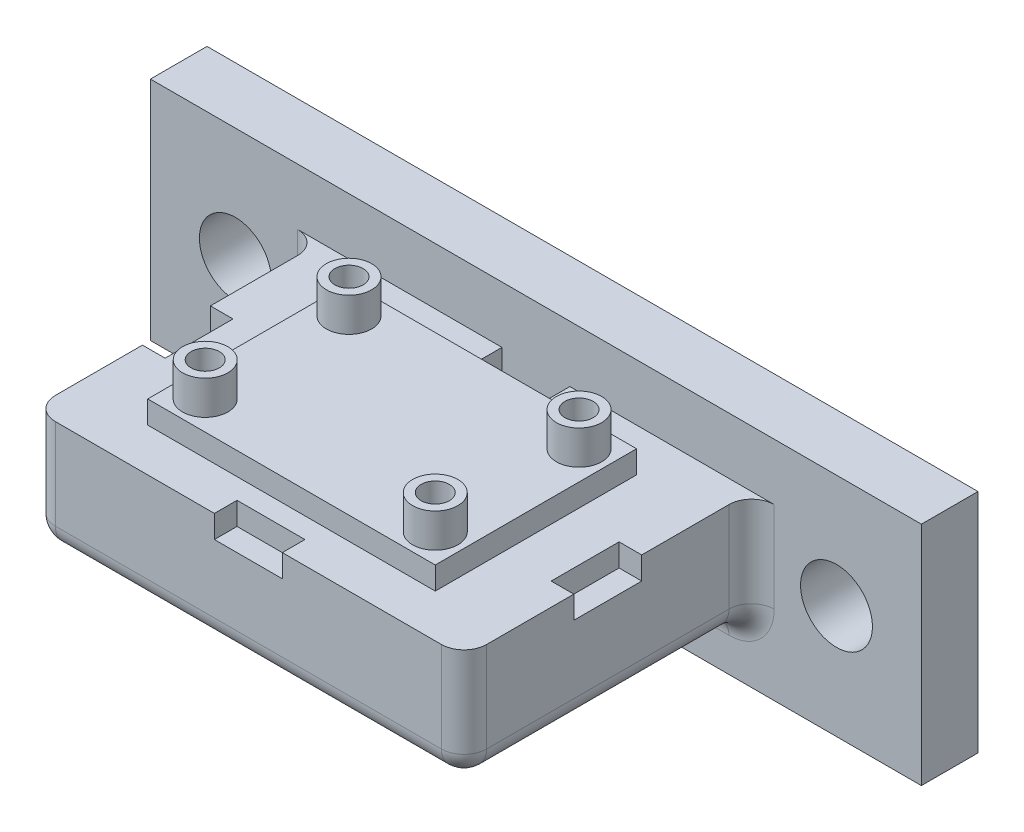
from build123d import *

# Parameters (mm, degrees)
SKETCH1_R             = 2
BOSS_EXTRUDE1_DEPTH   = 5
BOSS_EXTRUDE1_2_DEPTH = 5
BOSS_EXTRUDE1_3_DEPTH = 5
BOSS_EXTRUDE1_4_DEPTH = 5
SKETCH3_W             = 38.1
SKETCH3_H             = 25.4
BOSS_EXTRUDE2_DEPTH   = 10
SKETCH4_W             = 25.4
SKETCH4_H             = 17.78
BOSS_EXTRUDE3_DEPTH   = 2
SKETCH2_R             = 1.25
CUT_EXTRUDE1_DEPTH    = 10
SKETCH6_W             = 5.998216144
SKETCH6_H             = 2
CUT_EXTRUDE3_DEPTH    = 2
SKETCH7_W             = 6
SKETCH7_H             = 2
CUT_EXTRUDE4_DEPTH    = 2
SKETCH8_W             = 68.1
SKETCH8_H             = 20
BOSS_EXTRUDE4_DEPTH   = 5
SKETCH9_R             = 3.175
CUT_EXTRUDE5_DEPTH    = 5
FILLET1_R             = 2


with BuildPart() as part:
    # Sketch1 → Boss-Extrude1 (new body)
    with BuildSketch(Plane(origin=(0, 0, 0), x_dir=(1, 0, 0), z_dir=(0, 1, 0))):
        with Locations(Location((-10.16, 6.35, 0), (0, 0, 270))):
            Circle(SKETCH1_R)
    extrude(amount=BOSS_EXTRUDE1_DEPTH)



with BuildPart() as body_2:
    # Sketch1 → Boss-Extrude1 2 (new body)
    with BuildSketch(Plane(origin=(0, 0, 0), x_dir=(1, 0, 0), z_dir=(0, 1, 0))):
        with Locations(Location((10.16, 6.35, 0), (0, 0, 270))):
            Circle(SKETCH1_R)
    extrude(amount=BOSS_EXTRUDE1_2_DEPTH)


with BuildPart() as body_3:
    # Sketch1 → Boss-Extrude1 3 (new body)
    with BuildSketch(Plane(origin=(0, 0, 0), x_dir=(1, 0, 0), z_dir=(0, 1, 0))):
        with Locations(Location((10.16, -6.35, 0), (0, 0, 270))):
            Circle(SKETCH1_R)
    extrude(amount=BOSS_EXTRUDE1_3_DEPTH)


with BuildPart() as body_4:
    # Sketch1 → Boss-Extrude1 4 (new body)
    with BuildSketch(Plane(origin=(0, 0, 0), x_dir=(1, 0, 0), z_dir=(0, 1, 0))):
        with Locations(Location((-10.16, -6.35, 0), (0, 0, 270))):
            Circle(SKETCH1_R)
    extrude(amount=BOSS_EXTRUDE1_4_DEPTH)


with BuildPart() as part_1:
    add(part.part)

    add(body_2.part)  # Boss-Extrude2 merges body 2

    add(body_3.part)  # Boss-Extrude2 merges body 3

    add(body_4.part)  # Boss-Extrude2 merges body 4
    # Sketch3 → Boss-Extrude2 (add)
    with BuildSketch(Plane.XZ):
        Rectangle(SKETCH3_W, SKETCH3_H)
    extrude(amount=BOSS_EXTRUDE2_DEPTH)

    # Sketch4 → Boss-Extrude3 (add)
    with BuildSketch(Plane(origin=(0, 0, 0), x_dir=(1, 0, 0), z_dir=(0, 1, 0))):
        Rectangle(SKETCH4_W, SKETCH4_H)
    extrude(amount=BOSS_EXTRUDE3_DEPTH)

    # Sketch2 → Cut-Extrude1 (cut)
    with BuildSketch(Plane(origin=(0, 5, 0), x_dir=(1, 0, 0), z_dir=(0, 1, 0))):
        with Locations(Location((-10.16, 6.35, 0), (0, 0, 270))):
            Circle(SKETCH2_R)
        with Locations(Location((10.16, 6.35, 0), (0, 0, 270))):
            Circle(SKETCH2_R)
        with Locations(Location((10.16, -6.35, 0), (0, 0, 270))):
            Circle(SKETCH2_R)
        with Locations(Location((-10.16, -6.35, 0), (0, 0, 270))):
            Circle(SKETCH2_R)
    extrude(amount=-CUT_EXTRUDE1_DEPTH, mode=Mode.SUBTRACT)

    # Sketch6 → Cut-Extrude3 (cut)
    with BuildSketch(Plane(origin=(0, 0, -12.7), x_dir=(-1, 0, 0), z_dir=(0, 0, -1))):
        with Locations((0, -1)):
            Rectangle(SKETCH6_W, SKETCH6_H)
    cut_extrude3 = extrude(amount=-CUT_EXTRUDE3_DEPTH, mode=Mode.SUBTRACT)

    # Mirror1: Cut-Extrude3 across plane
    add(cut_extrude3.mirror(Plane.XY), mode=Mode.SUBTRACT)

    # Sketch7 → Cut-Extrude4 (cut)
    with BuildSketch(Plane.ZY.offset(19.05)):
        with Locations((0.00303896, -1)):
            Rectangle(SKETCH7_W, SKETCH7_H)
    cut_extrude4 = extrude(amount=-CUT_EXTRUDE4_DEPTH, mode=Mode.SUBTRACT)

    # Mirror2: Cut-Extrude4 across plane
    add(cut_extrude4.mirror(Plane(origin=(0, 0, 0), x_dir=(0, 0, 1), z_dir=(1, 0, 0))), mode=Mode.SUBTRACT)

    # Sketch8 → Boss-Extrude4 (add)
    with BuildSketch(Plane(origin=(0, 0, -12.7), x_dir=(-1, 0, 0), z_dir=(0, 0, -1))):
        with Locations((0, -5)):
            Rectangle(SKETCH8_W, SKETCH8_H)
    extrude(amount=BOSS_EXTRUDE4_DEPTH)

    # Sketch9 → Cut-Extrude5 (cut)
    with BuildSketch(Plane.XY.offset(-12.7)):
        with Locations((-26.55, -5)):
            Circle(SKETCH9_R)
        with Locations((26.55, -5)):
            Circle(SKETCH9_R)
    extrude(amount=-CUT_EXTRUDE5_DEPTH, mode=Mode.SUBTRACT)

    # Fillet1
    fillet1_edges = [part_1.edges().sort_by_distance(p)[0] for p in [
        (-19.05, -5, 12.7),
        (-19.05, -5, -12.7),
        (19.05, -5, -12.7),
        (19.05, -5, 12.7),
        (-19.05, -10, 0),
        (0, -10, -12.7),
        (19.05, -10, 0),
        (0, -10, 12.7),
    ]]
    fillet(fillet1_edges, radius=FILLET1_R)


solid = part_1.part
